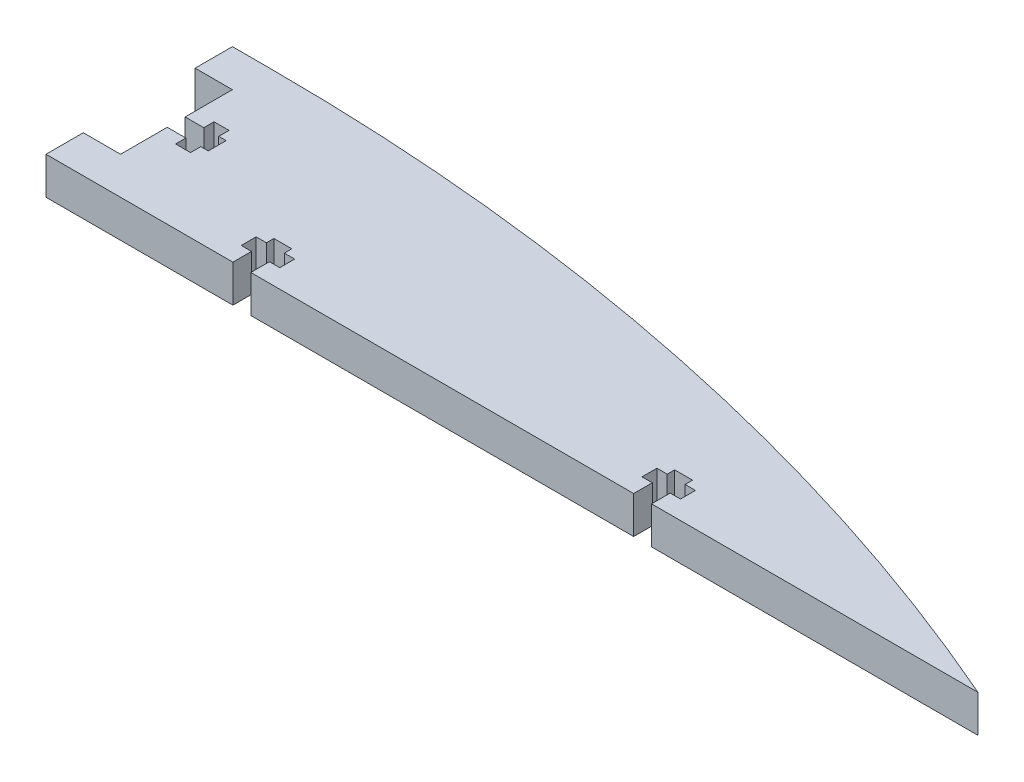
from build123d import *

# Parameters (mm, degrees)
BOSS_EXTRUDE1_DEPTH = 6.35


with BuildPart() as part:
    # Sketch1 → Boss-Extrude1 (new body)
    with BuildSketch(Plane(origin=(0, 0, 0), x_dir=(1, 0, 0), z_dir=(0, 1, 0))):
        with BuildLine():
            Line((-163.169535376, 1.165732309), (-163.169535376, -6.882681502))
            Line((-163.169535376, -6.882681502), (-159.994535376, -6.882681502))
            Line((-159.994535376, -6.882681502), (-159.994535376, -5.130081502))
            Line((-159.994535376, -5.130081502), (-157.454535376, -5.130081502))
            Line((-157.454535376, -5.130081502), (-157.454535376, -6.882681502))
            Line((-157.454535376, -6.882681502), (-156.184535376, -6.882681502))
            Line((-156.184535376, -6.882681502), (-156.184535376, -9.930540858))
            Line((-156.184535376, -9.930540858), (-157.454535376, -9.930540858))
            Line((-157.454535376, -9.930540858), (-157.454535376, -11.683140858))
            Line((-157.454535376, -11.683140858), (-159.994535376, -11.683140858))
            Line((-159.994535376, -11.683140858), (-159.994535376, -9.930540858))
            Line((-159.994535376, -9.930540858), (-163.169535376, -9.930540858))
            Line((-163.169535376, -9.930540858), (-163.169535376, -17.884267691))
            Line((-163.169535376, -17.884267691), (-169.519535376, -17.884267691))
            Line((-169.519535376, -17.884267691), (-169.519535376, -24.234267691))
            Line((-169.519535376, -24.234267691), (-137.68483349, -24.234267691))
            Line((-137.68483349, -24.234267691), (-137.68483349, -21.059267691))
            Line((-137.68483349, -21.059267691), (-139.43743349, -21.059267691))
            Line((-139.43743349, -21.059267691), (-139.43743349, -18.519267691))
            Line((-139.43743349, -18.519267691), (-137.68483349, -18.519267691))
            Line((-137.68483349, -18.519267691), (-137.68483349, -17.249267691))
            Line((-137.68483349, -17.249267691), (-134.636974134, -17.249267691))
            Line((-134.636974134, -17.249267691), (-134.636974134, -18.519267691))
            Line((-134.636974134, -18.519267691), (-132.884374134, -18.519267691))
            Line((-132.884374134, -18.519267691), (-132.884374134, -21.059267691))
            Line((-132.884374134, -21.059267691), (-134.636974134, -21.059267691))
            Line((-134.636974134, -21.059267691), (-134.636974134, -24.234267691))
            Line((-134.636974134, -24.234267691), (-69.42233349, -24.234267691))
            Line((-69.42233349, -24.234267691), (-69.42233349, -21.059267691))
            Line((-69.42233349, -21.059267691), (-71.17493349, -21.059267691))
            Line((-71.17493349, -21.059267691), (-71.17493349, -18.519267691))
            Line((-71.17493349, -18.519267691), (-69.42233349, -18.519267691))
            Line((-69.42233349, -18.519267691), (-69.42233349, -17.249267691))
            Line((-69.42233349, -17.249267691), (-66.374474134, -17.249267691))
            Line((-66.374474134, -17.249267691), (-66.374474134, -18.519267691))
            Line((-66.374474134, -18.519267691), (-64.621874134, -18.519267691))
            Line((-64.621874134, -18.519267691), (-64.621874134, -21.059267691))
            Line((-64.621874134, -21.059267691), (-66.374474134, -21.059267691))
            Line((-66.374474134, -21.059267691), (-66.374474134, -24.234267691))
            Line((-66.374474134, -24.234267691), (-10.769535376, -24.234267691))
            ThreePointArc((-10.769535376, -24.234267691), (-85.333453608, -0.506075205), (-163.169535376, 7.515732309))
            Line((-163.169535376, 7.515732309), (-169.519535376, 7.515732309))
            Line((-169.519535376, 7.515732309), (-169.519535376, 1.165732309))
            Line((-169.519535376, 1.165732309), (-163.169535376, 1.165732309))
        make_face()
    extrude(amount=BOSS_EXTRUDE1_DEPTH)


solid = part.part
